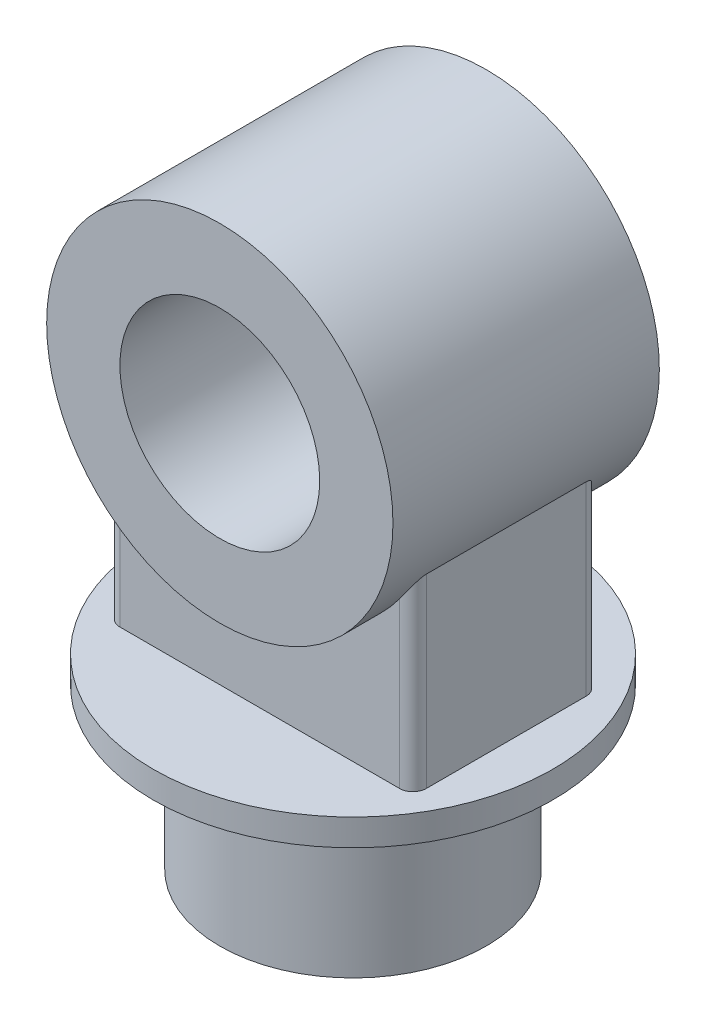
from build123d import *

# Parameters (mm, degrees)
SKETCH1_R                = 100
BOSS_EXTRUDE1_DEPTH      = 120
SKETCH2_R                = 150
BOSS_EXTRUDE2_DEPTH      = 20
SKETCH4_R                = 130
SKETCH4_R_2              = 75
BOSS_EXTRUDE3_DEPTH      = 100
BOSS_EXTRUDE4_REACH      = 394.301
BOSS_EXTRUDE4_END_RADIUS = 130
SKETCH5_W                = 230
SKETCH5_H                = 140
FILLET1_R                = 10


with BuildPart() as part:
    # Sketch1 → Boss-Extrude1 (new body)
    with BuildSketch(Plane(origin=(0, 0, 0), x_dir=(1, 0, 0), z_dir=(0, 1, 0))):
        with Locations(Location((0, 0, 0), (0, 0, 270))):
            Circle(SKETCH1_R)
    extrude(amount=BOSS_EXTRUDE1_DEPTH)

    # Sketch2 → Boss-Extrude2 (add)
    with BuildSketch(Plane(origin=(0, 120, 0), x_dir=(1, 0, 0), z_dir=(0, 1, 0))):
        with Locations(Location((0, 0, 0), (0, 0, 270))):
            Circle(SKETCH2_R)
    extrude(amount=BOSS_EXTRUDE2_DEPTH)



with BuildPart() as body_2:
    # Sketch4 → Boss-Extrude3 (new, symmetric)
    with BuildSketch(Plane.XY):
        with Locations((0, 340)):
            Circle(SKETCH4_R)
        with Locations((0, 340)):
            Circle(SKETCH4_R_2, mode=Mode.SUBTRACT)
    extrude(amount=BOSS_EXTRUDE3_DEPTH, both=True)


with BuildPart() as part_1:
    add(part.part)

    add(body_2.part)  # Boss-Extrude4 merges body 2
    # Boss-Extrude4: up to this cylinder (the profile starts outside it)
    boss_extrude4_end = Plane(origin=(0, 340, 0), z_dir=(0, 0, -1)) * Cylinder(BOSS_EXTRUDE4_END_RADIUS, 1049.602, mode=Mode.PRIVATE)
    # Sketch5 → Boss-Extrude4 (add, up to the surface)
    with BuildSketch(Plane(origin=(0, 140, 0), x_dir=(1, 0, 0), z_dir=(0, 1, 0)), mode=Mode.PRIVATE) as boss_extrude4_sk1:
        Rectangle(SKETCH5_W, SKETCH5_H)
    boss_extrude4_tool1 = extrude(boss_extrude4_sk1.sketch, amount=BOSS_EXTRUDE4_REACH, mode=Mode.PRIVATE) - boss_extrude4_end
    add(boss_extrude4_tool1.solids().sort_by_distance((0, 140, 0))[0])

    # Fillet1
    fillet1_edges = [part_1.edges().sort_by_distance(p)[0] for p in [
        (115, 209.689110868, -70),
        (115, 209.689110868, 70),
        (-115, 209.689110868, -70),
        (-115, 209.689110868, 70),
    ]]
    fillet(fillet1_edges, radius=FILLET1_R)


solid = part_1.part
